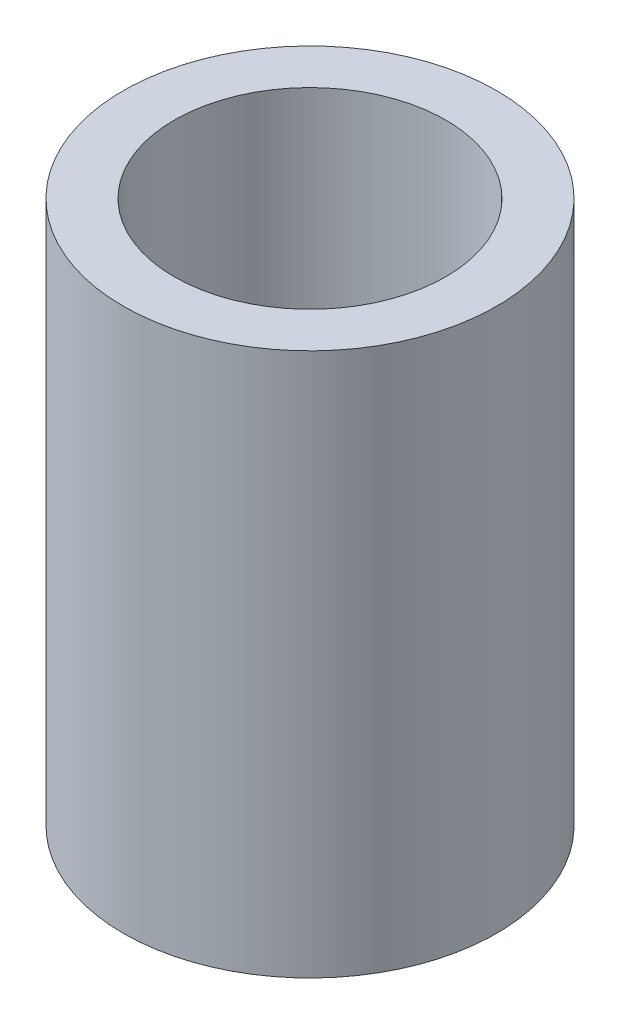
from build123d import *

# Parameters (mm, degrees)
CROQUIS2_R              = 5.5
SALIENTE_EXTRUIR2_DEPTH = 16
CORTAR_EXTRUIR1_REACH   = 19.79
CROQUIS3_R              = 4


with BuildPart() as part:
    # Croquis2 → Saliente-Extruir2 (new body)
    with BuildSketch(Plane(origin=(0, 0, 0), x_dir=(1, 0, 0), z_dir=(0, 1, 0))):
        with Locations(Location((0, 0, 0), (0, 0, 270))):
            Circle(CROQUIS2_R)
    extrude(amount=SALIENTE_EXTRUIR2_DEPTH)

    # Croquis3 → Cortar-Extruir1 (cut, up to next)
    with BuildSketch(Plane(origin=(0, 16, 0), x_dir=(1, 0, 0), z_dir=(0, 1, 0)), mode=Mode.PRIVATE) as cortar_extruir1_sk1:
        with Locations(Location((0, 0, 0), (0, 0, 270))):
            Circle(CROQUIS3_R)
    cortar_extruir1_tool1 = extrude(cortar_extruir1_sk1.sketch, amount=-CORTAR_EXTRUIR1_REACH, mode=Mode.PRIVATE) & part.part
    add(cortar_extruir1_tool1.solids().sort_by_distance((0, 16, 0))[0], mode=Mode.SUBTRACT)


solid = part.part
